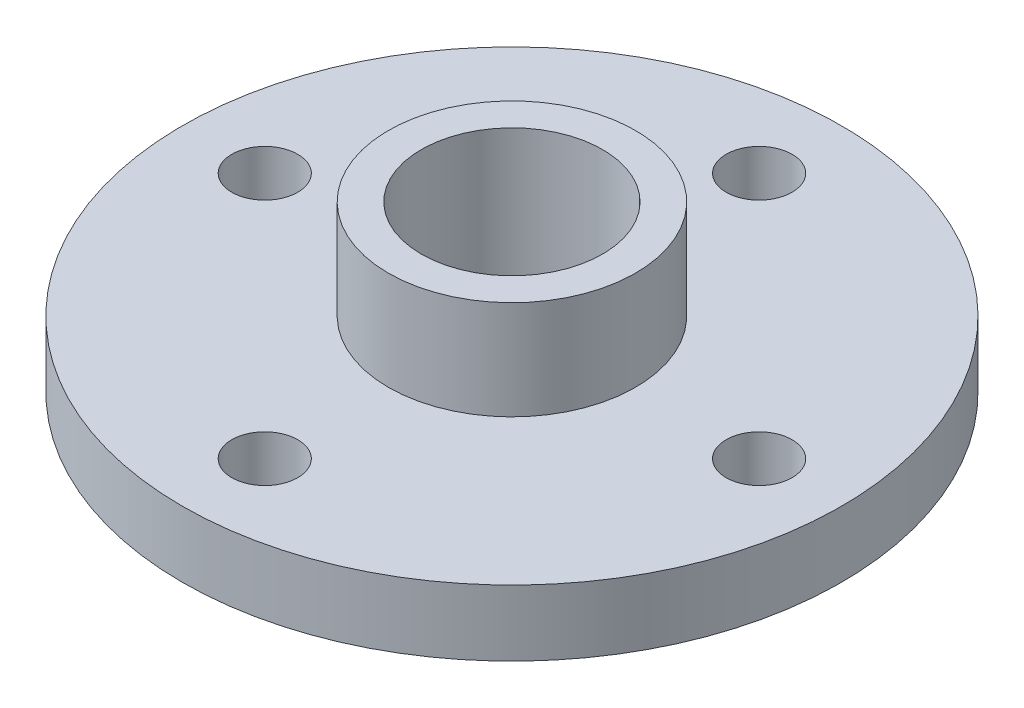
from build123d import *

# Parameters (mm, degrees)
SKETCH2_R           = 10
BOSS_EXTRUDE1_DEPTH = 2
SKETCH3_R           = 1
CUT_EXTRUDE1_DEPTH  = 15.282856857
SKETCH4_R           = 3.75
BOSS_EXTRUDE2_DEPTH = 3
SKETCH5_R           = 1.5
CUT_EXTRUDE2_DEPTH  = 16
SKETCH6_R           = 2.75
CUT_EXTRUDE3_DEPTH  = 4.5


with BuildPart() as part:
    # Sketch2 → Boss-Extrude1 (new body)
    with BuildSketch(Plane(origin=(0, 0, 0), x_dir=(1, 0, 0), z_dir=(0, 1, 0))):
        with Locations(Location((0, 0, 0), (0, 0, 270))):
            Circle(SKETCH2_R)
    extrude(amount=BOSS_EXTRUDE1_DEPTH)

    # Sketch3 → Cut-Extrude1 (cut, through all)
    with BuildSketch(Plane(origin=(0, 2, 0), x_dir=(1, 0, 0), z_dir=(0, 1, 0))):
        with Locations(Location((0, 7.5, 0), (0, 0, 270))):
            Circle(SKETCH3_R)
        with Locations(Location((7.5, 0, 0), (0, 0, 270))):
            Circle(SKETCH3_R)
        with Locations(Location((0, -7.5, 0), (0, 0, 90))):
            Circle(SKETCH3_R)
        with Locations(Location((-7.5, 0, 0), (0, 0, 90))):
            Circle(SKETCH3_R)
    extrude(amount=-CUT_EXTRUDE1_DEPTH, mode=Mode.SUBTRACT)

    # Sketch4 → Boss-Extrude2 (add)
    with BuildSketch(Plane(origin=(0, 2, 0), x_dir=(1, 0, 0), z_dir=(0, 1, 0))):
        with Locations(Location((0, 0, 0), (0, 0, 270))):
            Circle(SKETCH4_R)
    extrude(amount=BOSS_EXTRUDE2_DEPTH)

    # Sketch5 → Cut-Extrude2 (cut, through all)
    with BuildSketch(Plane(origin=(0, 5, 0), x_dir=(1, 0, 0), z_dir=(0, 1, 0))):
        with Locations(Location((0, 0, 0), (0, 0, 270))):
            Circle(SKETCH5_R)
    extrude(amount=-CUT_EXTRUDE2_DEPTH, mode=Mode.SUBTRACT)

    # Sketch6 → Cut-Extrude3 (cut)
    with BuildSketch(Plane(origin=(0, 5, 0), x_dir=(1, 0, 0), z_dir=(0, 1, 0))):
        with Locations(Location((0, 0, 0), (0, 0, 270))):
            Circle(SKETCH6_R)
    extrude(amount=-CUT_EXTRUDE3_DEPTH, mode=Mode.SUBTRACT)


solid = part.part
